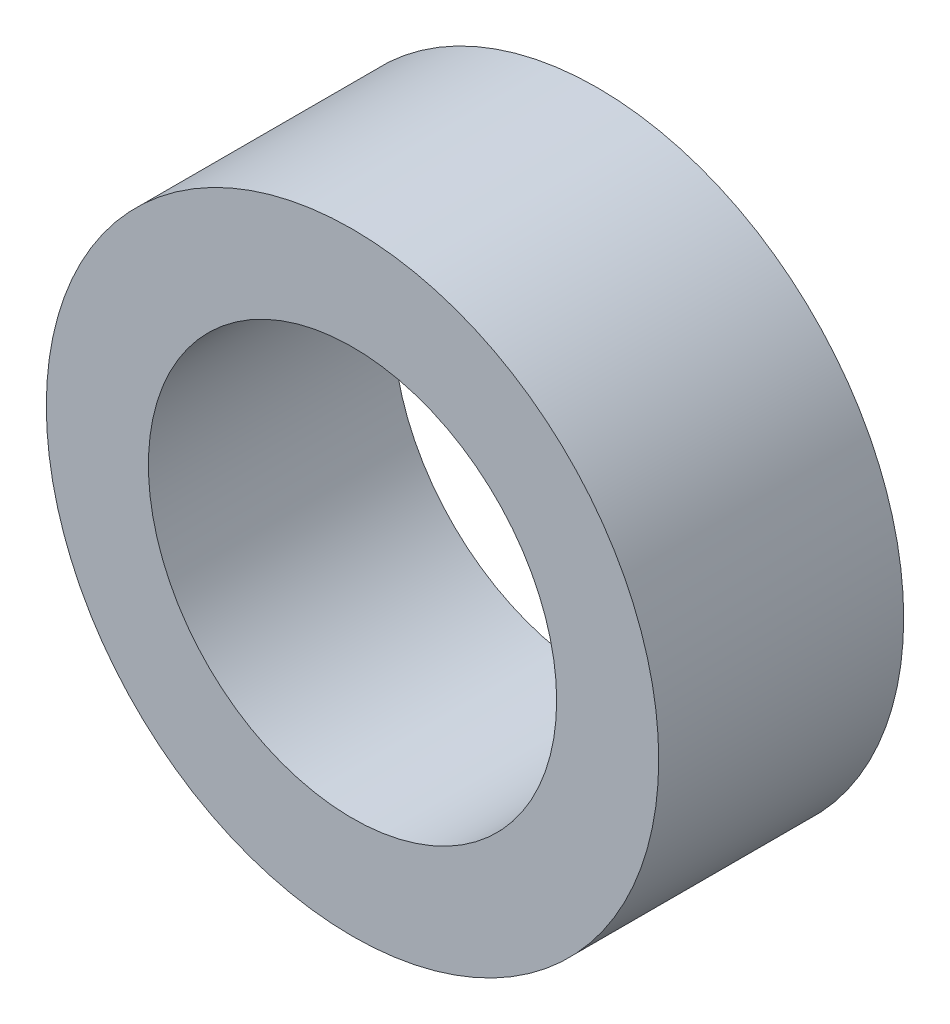
from build123d import *

# Parameters (mm, degrees)
ESBO_O1_R                = 3.75
ESBO_O1_R_2              = 2.5
RESSALTO_EXTRUS_O1_DEPTH = 1.5


with BuildPart() as part:
    # Esboço1 → Ressalto-extrusão1 (new, symmetric)
    with BuildSketch(Plane.XY):
        Circle(ESBO_O1_R)
        Circle(ESBO_O1_R_2, mode=Mode.SUBTRACT)
    extrude(amount=RESSALTO_EXTRUS_O1_DEPTH, both=True)


solid = part.part
